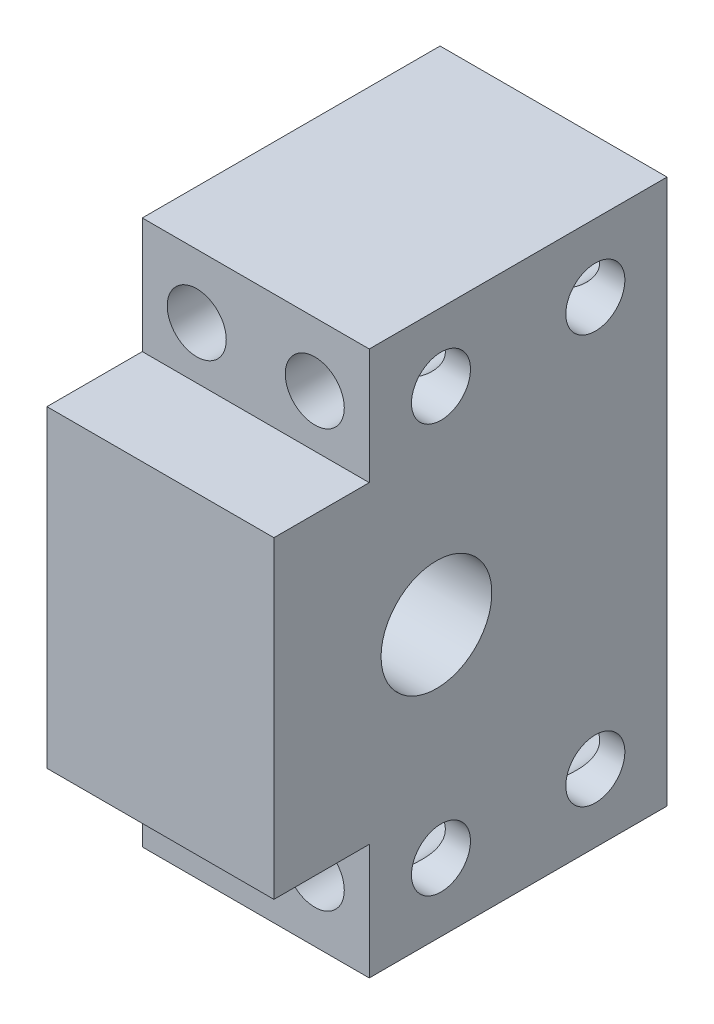
from build123d import *

# Parameters (mm, degrees)
SKETCH1_W           = 25
SKETCH1_H           = 34.5
SKETCH1_H_2         = 12.75
SKETCH1_R           = 3.25
BOSS_EXTRUDE1_DEPTH = 32.8
BOSS_EXTRUDE2_START = 32.8
SKETCH1_3_W         = 25
SKETCH1_3_H         = 34.5
BOSS_EXTRUDE2_DEPTH = 10.5
CUT_EXTRUDE1_REACH  = 342.376
SKETCH2_R           = 3.25
SKETCH2_R_2         = 6.1


with BuildPart() as part:
    # Sketch1 → Boss-Extrude1 (new body)
    # profile 1 of 3: a face of its own
    with BuildSketch(Plane.XY):
        with Locations((323.774999942, 0)):
            Rectangle(SKETCH1_W, SKETCH1_H)
    # profile 2 of 3: a face of its own
    with BuildSketch(Plane.XY):
        with Locations((323.774999942, 23.625)):
            Rectangle(SKETCH1_W, SKETCH1_H_2)
        with Locations((317.274999942, 23)):
            Circle(SKETCH1_R, mode=Mode.SUBTRACT)
        with Locations((330.274999942, 23)):
            Circle(SKETCH1_R, mode=Mode.SUBTRACT)
    # profile 3 of 3: a face of its own
    with BuildSketch(Plane.XY):
        with Locations((323.774999942, -23.625)):
            Rectangle(SKETCH1_W, SKETCH1_H_2)
        with Locations((317.274999942, -23)):
            Circle(SKETCH1_R, mode=Mode.SUBTRACT)
        with Locations((330.274999942, -23)):
            Circle(SKETCH1_R, mode=Mode.SUBTRACT)
    extrude(amount=BOSS_EXTRUDE1_DEPTH)

    # Sketch1<3> → Boss-Extrude2 (add)
    with BuildSketch(Plane.XY.offset(BOSS_EXTRUDE2_START)):
        with Locations((323.774999942, 0)):
            Rectangle(SKETCH1_3_W, SKETCH1_3_H)
    extrude(amount=BOSS_EXTRUDE2_DEPTH)

    # Cut-Extrude1: up to this face of the body (flat: up to its plane)
    cut_extrude1_end = Plane(part.part.faces().sort_by_distance((336.274999942, 0, 19.765609913))[0])
    # Sketch2 → Cut-Extrude1 (cut, up to the picked face)
    with BuildSketch(Plane(origin=(0, 0, 0), x_dir=(0, 0, -1), z_dir=(1, 0, 0)), mode=Mode.PRIVATE) as cut_extrude1_sk1:
        with Locations(Location((-24.9, 22.5, 0), (0, 0, 180))):
            Circle(SKETCH2_R)
    cut_extrude1_tool1 = split(extrude(cut_extrude1_sk1.sketch, amount=CUT_EXTRUDE1_REACH, mode=Mode.PRIVATE), bisect_by=cut_extrude1_end, keep=Keep.BOTH, mode=Mode.PRIVATE)
    # Sketch2 → Cut-Extrude1 (cut, up to the picked face)
    with BuildSketch(Plane(origin=(0, 0, 0), x_dir=(0, 0, -1), z_dir=(1, 0, 0)), mode=Mode.PRIVATE) as cut_extrude1_sk2:
        with Locations(Location((-7.9, 22.5, 0), (0, 0, 180))):
            Circle(SKETCH2_R)
    cut_extrude1_tool2 = split(extrude(cut_extrude1_sk2.sketch, amount=CUT_EXTRUDE1_REACH, mode=Mode.PRIVATE), bisect_by=cut_extrude1_end, keep=Keep.BOTH, mode=Mode.PRIVATE)
    # Sketch2 → Cut-Extrude1 (cut, up to the picked face)
    with BuildSketch(Plane(origin=(0, 0, 0), x_dir=(0, 0, -1), z_dir=(1, 0, 0)), mode=Mode.PRIVATE) as cut_extrude1_sk3:
        with Locations(Location((-7.9, -22.5, 0), (0, 0, 180))):
            Circle(SKETCH2_R)
    cut_extrude1_tool3 = split(extrude(cut_extrude1_sk3.sketch, amount=CUT_EXTRUDE1_REACH, mode=Mode.PRIVATE), bisect_by=cut_extrude1_end, keep=Keep.BOTH, mode=Mode.PRIVATE)
    # Sketch2 → Cut-Extrude1 (cut, up to the picked face)
    with BuildSketch(Plane(origin=(0, 0, 0), x_dir=(0, 0, -1), z_dir=(1, 0, 0)), mode=Mode.PRIVATE) as cut_extrude1_sk4:
        with Locations(Location((-24.9, -22.5, 0), (0, 0, 180))):
            Circle(SKETCH2_R)
    cut_extrude1_tool4 = split(extrude(cut_extrude1_sk4.sketch, amount=CUT_EXTRUDE1_REACH, mode=Mode.PRIVATE), bisect_by=cut_extrude1_end, keep=Keep.BOTH, mode=Mode.PRIVATE)
    # Sketch2 → Cut-Extrude1 (cut, up to the picked face)
    with BuildSketch(Plane(origin=(0, 0, 0), x_dir=(0, 0, -1), z_dir=(1, 0, 0)), mode=Mode.PRIVATE) as cut_extrude1_sk5:
        with Locations(Location((-25.4, 0, 0), (0, 0, 180))):
            Circle(SKETCH2_R_2)
    cut_extrude1_tool5 = split(extrude(cut_extrude1_sk5.sketch, amount=CUT_EXTRUDE1_REACH, mode=Mode.PRIVATE), bisect_by=cut_extrude1_end, keep=Keep.BOTH, mode=Mode.PRIVATE)
    add(cut_extrude1_tool1.solids().sort_by(Axis((0, 22.5, 24.9), (1, 0, 0)))[0], mode=Mode.SUBTRACT)
    add(cut_extrude1_tool2.solids().sort_by(Axis((0, 22.5, 7.9), (1, 0, 0)))[0], mode=Mode.SUBTRACT)
    add(cut_extrude1_tool3.solids().sort_by(Axis((0, -22.5, 7.9), (1, 0, 0)))[0], mode=Mode.SUBTRACT)
    add(cut_extrude1_tool4.solids().sort_by(Axis((0, -22.5, 24.9), (1, 0, 0)))[0], mode=Mode.SUBTRACT)
    add(cut_extrude1_tool5.solids().sort_by(Axis((0, 0, 25.4), (1, 0, 0)))[0], mode=Mode.SUBTRACT)


solid = part.part
